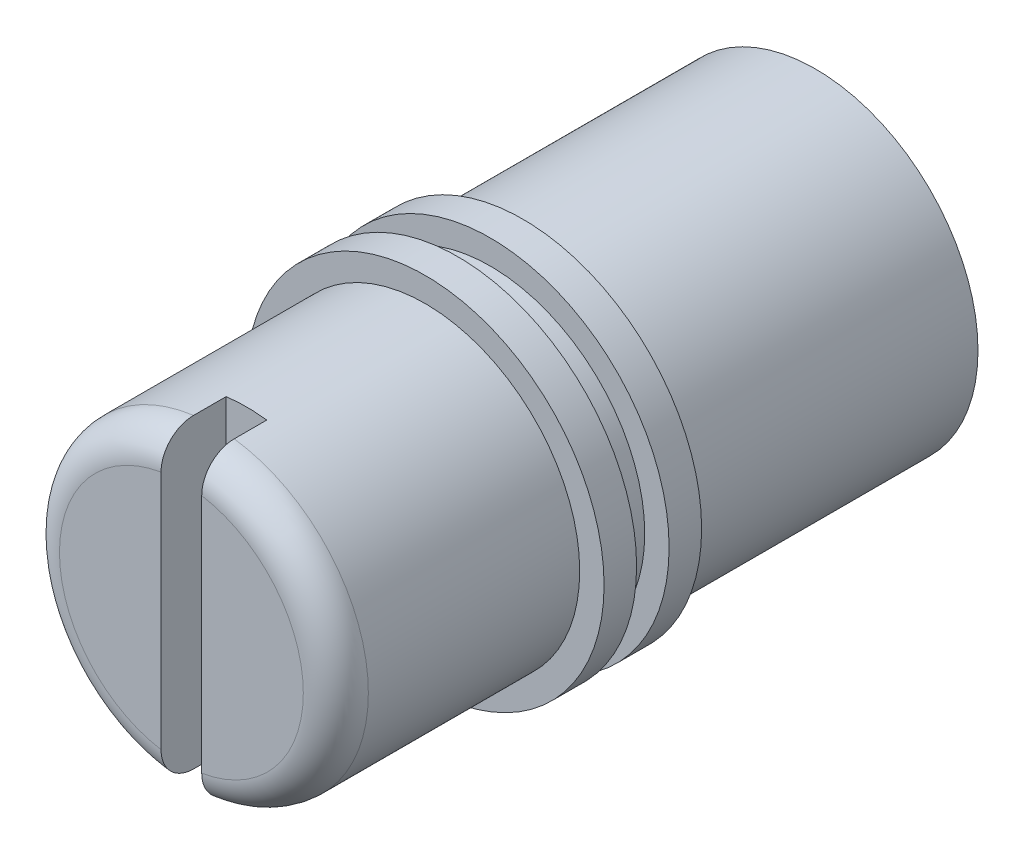
from build123d import *

# Parameters (mm, degrees)
SKETCH1_R           = 9.5
BOSS_EXTRUDE1_DEPTH = 19
SKETCH1_5_R         = 10
BOSS_EXTRUDE4_DEPTH = 20
BOSS_EXTRUDE2_START = 2
SKETCH1_3_R         = 11
SKETCH1_3_R_2       = 9.5
BOSS_EXTRUDE2_DEPTH = 2
SKETCH1_4_R         = 11
SKETCH1_4_R_2       = 10
BOSS_EXTRUDE3_DEPTH = 2
FILLET1_R           = 2
CUT_EXTRUDE3_START  = -4
CUT_EXTRUDE3_DEPTH  = 4
SKETCH6_R           = 5
CUT_EXTRUDE4_DEPTH  = 25


with BuildPart() as part:
    # Sketch1 → Boss-Extrude1 (new body)
    with BuildSketch(Plane.XY):
        Circle(SKETCH1_R)
    extrude(amount=BOSS_EXTRUDE1_DEPTH)

    # Sketch1<5> → Boss-Extrude4 (add)
    with BuildSketch(Plane.XY):
        Circle(SKETCH1_5_R)
    extrude(amount=-BOSS_EXTRUDE4_DEPTH)

    # Sketch1<3> → Boss-Extrude2 (add)
    with BuildSketch(Plane.XY.offset(BOSS_EXTRUDE2_START)):
        Circle(SKETCH1_3_R)
        Circle(SKETCH1_3_R_2, mode=Mode.SUBTRACT)
    extrude(amount=BOSS_EXTRUDE2_DEPTH)

    # Sketch1<4> → Boss-Extrude3 (add)
    with BuildSketch(Plane.XY):
        Circle(SKETCH1_4_R)
        Circle(SKETCH1_4_R_2, mode=Mode.SUBTRACT)
    extrude(amount=-BOSS_EXTRUDE3_DEPTH)

    # Fillet1
    fillet1_edges = [part.edges().sort_by_distance(p)[0] for p in [
        (-9.5, 0, 19),
    ]]
    fillet(fillet1_edges, radius=FILLET1_R)

    # Sketch4 → Cut-Extrude3 (cut)
    with BuildSketch(Plane.XY.offset(19).offset(CUT_EXTRUDE3_START)):
        with BuildLine():
            Line((-1.25, -9.417404101), (-1.25, 9.417404101))
            ThreePointArc((-1.25, 9.417404101), (0, 9.5), (1.25, 9.417404101))
            Line((1.25, 9.417404101), (1.25, -9.417404101))
            ThreePointArc((1.25, -9.417404101), (0, -9.5), (-1.25, -9.417404101))
        make_face()
    extrude(amount=CUT_EXTRUDE3_DEPTH, mode=Mode.SUBTRACT)

    # Sketch6 → Cut-Extrude4 (cut)
    with BuildSketch(Plane(origin=(0, 0, -20), x_dir=(-1, 0, 0), z_dir=(0, 0, -1))):
        Circle(SKETCH6_R)
    extrude(amount=-CUT_EXTRUDE4_DEPTH, mode=Mode.SUBTRACT)


solid = part.part
